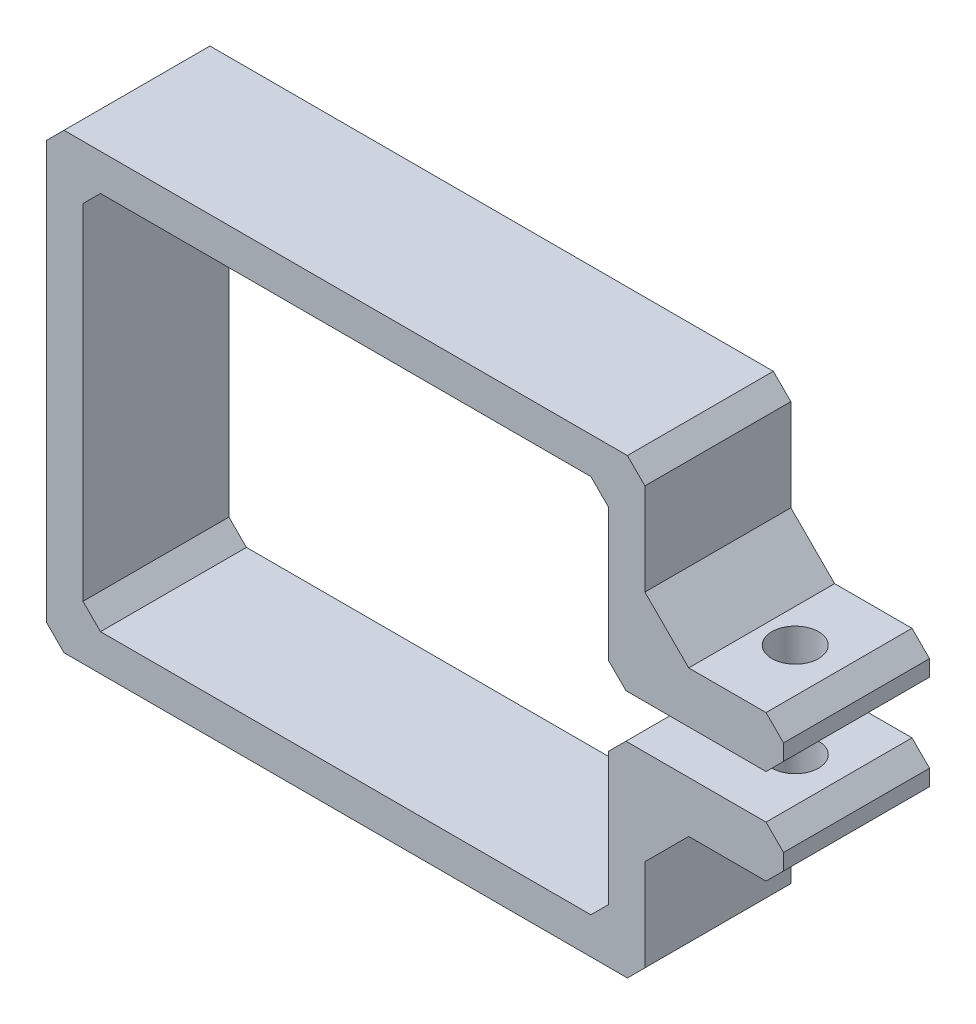
from build123d import *

# Parameters (mm, degrees)
SKETCH1_W           = 9.5
SKETCH1_H           = 3.5
SKETCH1_W_2         = 2.5
BOSS_EXTRUDE1_DEPTH = 10
CHAMFER1_SIZE       = 3
CHAMFER2_SIZE       = 1.2
SKETCH2_R           = 1.6
CUT_EXTRUDE1_DEPTH  = 10


with BuildPart() as part:
    # Sketch1 → Boss-Extrude1 (new body)
    with BuildSketch(Plane.XY):
        with Locations((25.25, 3.25)):
            Rectangle(SKETCH1_W, SKETCH1_H)
        Polygon((20.5, 15.5), (-20.5, 15.5), (-20.5, -15.5), (20.5, -15.5), (20.5, -5), (18, -5), (18, -13), (-18, -13), (-18, 13), (18, 13), (18, 5), (20.5, 5), align=None)
        with Locations((19.25, -3.25)):
            Rectangle(SKETCH1_W_2, SKETCH1_H)
        with Locations((19.25, 3.25)):
            Rectangle(SKETCH1_W_2, SKETCH1_H)
        with Locations((25.25, -3.25)):
            Rectangle(SKETCH1_W, SKETCH1_H)
    extrude(amount=BOSS_EXTRUDE1_DEPTH)

    # Chamfer1
    chamfer1_edges = [part.edges().sort_by_distance(p)[0] for p in [
        (20.5, -5, 5),
        (20.5, 5, 5),
    ]]
    chamfer(chamfer1_edges, length=CHAMFER1_SIZE)

    # Chamfer2
    chamfer2_edges = [part.edges().sort_by_distance(p)[0] for p in [
        (30, 5, 5),
        (30, 1.5, 5),
        (18, 1.5, 5),
        (18, 13, 5),
        (-18, 13, 5),
        (-18, -13, 5),
        (18, -13, 5),
        (18, -1.5, 5),
        (30, -1.5, 5),
        (30, -5, 5),
        (20.5, -15.5, 5),
        (-20.5, -15.5, 5),
        (-20.5, 15.5, 5),
        (20.5, 15.5, 5),
    ]]
    chamfer(chamfer2_edges, length=CHAMFER2_SIZE)

    # Sketch2 → Cut-Extrude1 (cut)
    with BuildSketch(Plane(origin=(0, 5, 0), x_dir=(1, 0, 0), z_dir=(0, 1, 0))):
        with Locations(Location((25.8, -5, 0), (0, 0, 180))):
            Circle(SKETCH2_R)
    extrude(amount=-CUT_EXTRUDE1_DEPTH, mode=Mode.SUBTRACT)


solid = part.part
